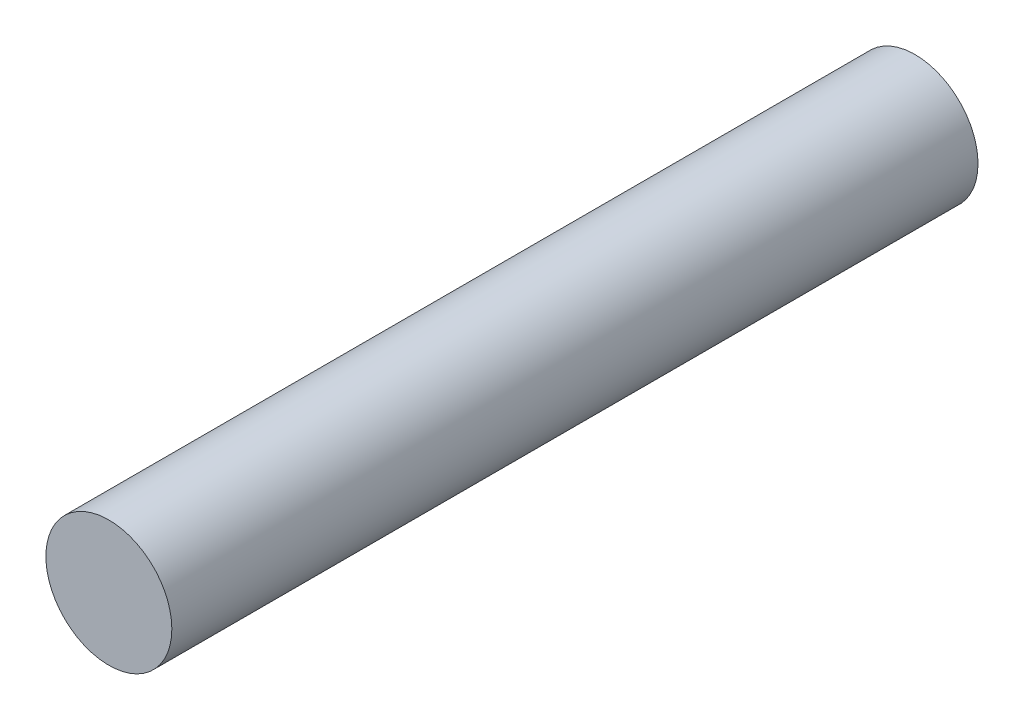
from build123d import *

# Parameters (mm, degrees)
SKETCH1_R           = 12.5
BOSS_EXTRUDE1_DEPTH = 160


with BuildPart() as part:
    # Sketch1 → Boss-Extrude1 (new body)
    with BuildSketch(Plane.XY):
        Circle(SKETCH1_R)
    extrude(amount=BOSS_EXTRUDE1_DEPTH)


solid = part.part
